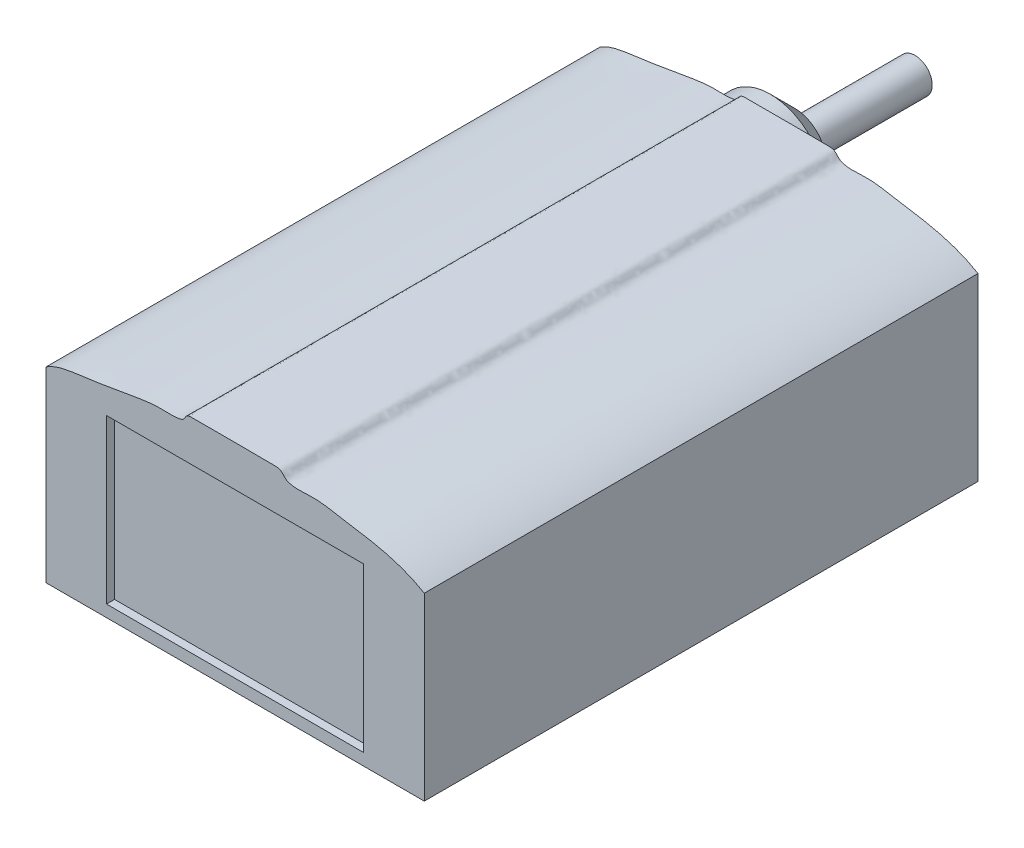
from build123d import *

# Parameters (mm, degrees)
EXTRUDE_1_DEPTH     = 68.9
SKETCH_3_R          = 6.95
EXTRUDE_2_DEPTH     = 12.8
CHAMFER_1_SIZE      = 3
SKETCH_4_R          = 2.135783825
EXTRUDE_3_DEPTH     = 15
SKETCH_5_W          = 32
SKETCH_5_H          = 20.32
CUT_EXTRUDE_1_DEPTH = 1


with BuildPart() as part:
    # Эскиз2 → Бобышка-Вытянуть1 (new body)
    with BuildSketch(Plane.XY):
        with BuildLine():
            Line((-188.051942113, -83.264171007), (-188.051942113, -106.521233953))
            Line((-188.051942113, -106.521233953), (-140.981942113, -106.521233953))
            Line((-140.981942113, -106.521233953), (-140.981942113, -84.109678038))
            add(Edge.make_bspline(
                [(-188.051942113, -83.264171007), (-186.751441625, -82.400103478), (-184.014745849, -82.098183961), (-180.269750478, -81.539300961), (-177.11443979, -80.966837329), (-174.129855052, -80.48790743), (-172.311248735, -80.726415641), (-170.781028922, -80.402149956), (-170.710950221, -79.66797894), (-168.676391514, -79.597454114), (-161.911227506, -79.674730736), (-158.755920697, -79.661056202), (-158.33866764, -80.450107039), (-156.859894774, -80.952439076), (-154.650535556, -80.50071138), (-151.070724866, -81.26707385), (-146.373565536, -81.897295087), (-142.926815312, -82.951640991), (-140.981942113, -84.109678038)],
                knots=[0, 0, 0, 0, 0.130688839, 0.231656249, 0.325449039, 0.407810964, 0.483444576, 0.495515392, 0.52485204, 0.540813638, 0.639169778, 0.65366229, 0.671246246, 0.679565076, 0.734652601, 0.804528184, 0.874806899, 1, 1, 1, 1], degree=3))
        make_face()
    extrude(amount=EXTRUDE_1_DEPTH)

    # Эскиз3 → Бобышка-Вытянуть2 (add)
    with BuildSketch(Plane(origin=(0, 0, 0), x_dir=(-1, 0, 0), z_dir=(0, 0, -1))):
        with Locations(Location((176.611079589, -94.458123157, 0), (0, 0, 180))):
            Circle(SKETCH_3_R)
    extrude(amount=EXTRUDE_2_DEPTH)

    # Фаска1
    chamfer_1_edges = [part.edges().sort_by_distance(p)[0] for p in [
        (-183.561079589, -94.458123157, -12.8),
    ]]
    chamfer(chamfer_1_edges, length=CHAMFER_1_SIZE)

    # Эскиз4 → Бобышка-Вытянуть3 (add)
    with BuildSketch(Plane(origin=(0, 0, -12.8), x_dir=(-1, 0, 0), z_dir=(0, 0, -1))):
        with Locations((176.611079589, -94.458123157)):
            Circle(SKETCH_4_R)
    extrude(amount=EXTRUDE_3_DEPTH)

    # Эскиз5 → Вырез-Вытянуть1 (cut)
    with BuildSketch(Plane.XY.offset(68.9)):
        with Locations((-164.516942113, -94.89270248)):
            Rectangle(SKETCH_5_W, SKETCH_5_H)
    extrude(amount=-CUT_EXTRUDE_1_DEPTH, mode=Mode.SUBTRACT)


solid = part.part
